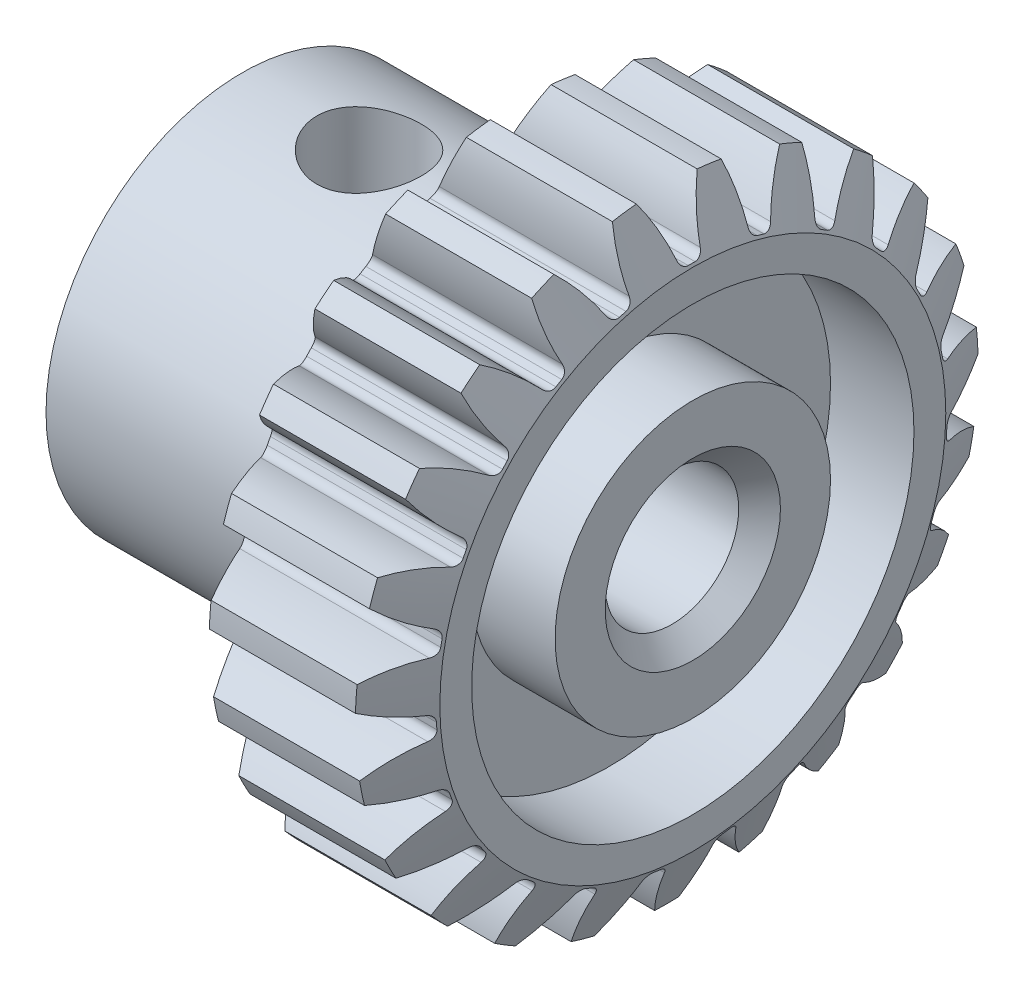
from build123d import *

# Parameters (mm, degrees)
SKETCH2_R                 = 1.6
CUT_EXTRUDE1_DEPTH        = 16.137370974
CHAMFER1_SIZE             = 0.5
M3X0_5_TAPPED_HOLE1_D     = 2.5
M3X0_5_TAPPED_HOLE1_DEPTH = 4
M3X0_5_TAPPED_HOLE1_TIP   = 0.751075774
CUT_EXTRUDE3_REACH        = 17.137
CIRPATTERN1_COUNT         = 23


with BuildPart() as part:
    # Sketch1 → Revolve1 (revolve)
    with BuildSketch(Plane.XY, mode=Mode.PRIVATE) as revolve1_sk:
        Polygon((-5.4, 0), (-5.4, 4.7), (0.65, 4.7), (0.65, 7.5), (5.4, 7.5), (5.4, 5.3), (3.4, 5.3), (3.4, 3.3), (5.4, 3.3), (5.4, 0), align=None)
    revolve(revolve1_sk.sketch.rotate(Axis((5.4, 0, 0), (-1, 0, 0)), 90), axis=Axis((5.4, 0, 0), (-1, 0, 0)))

    # Sketch2 → Cut-Extrude1 (cut, through all)
    with BuildSketch(Plane(origin=(5.4, 0, 0), x_dir=(0, 0, -1), z_dir=(1, 0, 0))):
        Circle(SKETCH2_R)
    extrude(amount=-CUT_EXTRUDE1_DEPTH, mode=Mode.SUBTRACT)

    # Chamfer1
    chamfer1_edges = [part.edges().sort_by_distance(p)[0] for p in [
        (-5.4, 0, 1.6),
        (5.4, 0, 1.6),
    ]]
    chamfer(chamfer1_edges, length=CHAMFER1_SIZE)

    # M3x0.5 Tapped Hole1
    with Locations(Plane(origin=(-2.358336803, 4.7, 0), x_dir=(0, 0, 1), z_dir=(0, 1, 0))):
        with Locations((0, 0)):
            Hole(M3X0_5_TAPPED_HOLE1_D / 2, depth=M3X0_5_TAPPED_HOLE1_DEPTH)
            with Locations((0, 0, -(M3X0_5_TAPPED_HOLE1_DEPTH + M3X0_5_TAPPED_HOLE1_TIP / 2))):  # 118° drill point
                Cone(0, M3X0_5_TAPPED_HOLE1_D / 2, M3X0_5_TAPPED_HOLE1_TIP, mode=Mode.SUBTRACT)

    # Sketch9 → Cut-Extrude3 (cut, up to next)
    with BuildSketch(Plane(origin=(5.4, 0, 0), x_dir=(0, 0, -1), z_dir=(1, 0, 0)), mode=Mode.PRIVATE) as cut_extrude3_sk1:
        with BuildLine():
            ThreePointArc((0.081182766, 6.124461965), (0, 6.125), (-0.081182766, 6.124461965))
            ThreePointArc((-0.081182766, 6.124461965), (-0.209219306, 6.168629017), (-0.279753713, 6.28425333))
            ThreePointArc((-0.279753713, 6.28425333), (-0.489133129, 6.959172982), (-0.826540275, 7.580069668))
            ThreePointArc((-0.826540275, 7.580069668), (0, 7.625), (0.826540275, 7.580069668))
            ThreePointArc((0.826540275, 7.580069668), (0.489133129, 6.959172982), (0.279753713, 6.28425333))
            ThreePointArc((0.279753713, 6.28425333), (0.209219306, 6.168629017), (0.081182766, 6.124461965))
        make_face()
    cut_extrude3_tool1 = extrude(cut_extrude3_sk1.sketch, amount=-CUT_EXTRUDE3_REACH, mode=Mode.PRIVATE) & part.part
    cut_extrude3 = cut_extrude3_tool1.solids().sort_by_distance((5.4, 7.024477, 0))[0]
    add(cut_extrude3, mode=Mode.SUBTRACT)

    # CirPattern1: Cut-Extrude3 ×23 about axis
    cirpattern1_axis = Axis((0, 0, 0), (1, 0, 0))
    for i in range(1, CIRPATTERN1_COUNT):
        add(cut_extrude3.rotate(cirpattern1_axis, i * 360 / CIRPATTERN1_COUNT), mode=Mode.SUBTRACT)

    # Sketch10 → Cut-Revolve1 (revolve, cut)
    with BuildSketch(Plane.XY, mode=Mode.PRIVATE) as cut_revolve1_sk:
        Polygon((5.4, 6.062405778), (4.775, 7.462405778), (1.275, 7.462405778), (0.65, 6.062405778), (-0.635142287, 6.636130013), (0.180159394, 8.462405778), (5.869840606, 8.462405778), (6.685142287, 6.636130013), align=None)
    revolve(cut_revolve1_sk.sketch.rotate(Axis((-4.9, 0, 0), (1, 0, 0)), 90), axis=Axis((-4.9, 0, 0), (1, 0, 0)), mode=Mode.SUBTRACT)


solid = part.part
